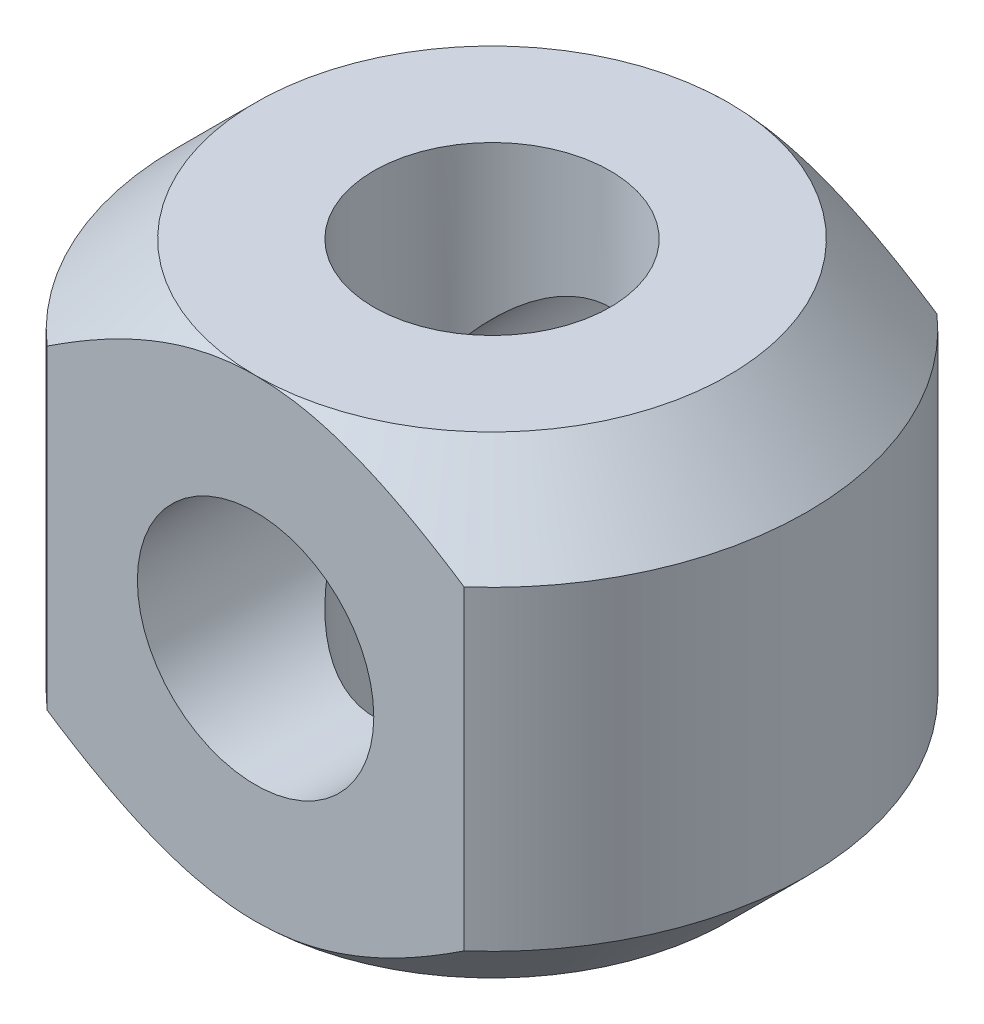
from build123d import *

# Parameters (mm, degrees)
CROQUIS1_R                 = 4
CROQUIS1_R_2               = 1.5
SALIENTE_EXTRUIR3_DEPTH    = 6
CHAFL_N1_SIZE              = 1
CHAFL_N2_SIZE              = 1
CORTAR_EXTRUIR2_DEPTH      = 4
CORTAR_EXTRUIR2_DEPTH_BACK = 4
CROQUIS3_W                 = 2
CROQUIS3_H                 = 6
CROQUIS4_R                 = 1.5
CORTAR_EXTRUIR3_DEPTH      = 6


with BuildPart() as part:
    # Croquis1 → Saliente-Extruir3 (new body)
    with BuildSketch(Plane(origin=(0, 0, 0), x_dir=(1, 0, 0), z_dir=(0, 1, 0))):
        Circle(CROQUIS1_R)
        Circle(CROQUIS1_R_2, mode=Mode.SUBTRACT)
    extrude(amount=SALIENTE_EXTRUIR3_DEPTH)

    # Chaflán1
    chafl_n1_edges = [part.edges().sort_by_distance(p)[0] for p in [
        (-4, 6, 0),
    ]]
    chamfer(chafl_n1_edges, length=CHAFL_N1_SIZE)

    # Chaflán2
    chafl_n2_edges = [part.edges().sort_by_distance(p)[0] for p in [
        (-4, 0, 0),
    ]]
    chamfer(chafl_n2_edges, length=CHAFL_N2_SIZE)

    # Croquis3 → Cortar-Extruir2 (cut, two sides: drawn at the far end of the back side and taken through both)
    with BuildSketch(Plane(origin=(0, 0, 0), x_dir=(0, 0, -1), z_dir=(1, 0, 0)).offset(-CORTAR_EXTRUIR2_DEPTH_BACK)):
        with Locations((-4, 3)):
            Rectangle(CROQUIS3_W, CROQUIS3_H)
        with Locations((4, 3)):
            Rectangle(CROQUIS3_W, CROQUIS3_H)
    extrude(amount=CORTAR_EXTRUIR2_DEPTH + CORTAR_EXTRUIR2_DEPTH_BACK, mode=Mode.SUBTRACT)

    # Croquis4 → Cortar-Extruir3 (cut)
    with BuildSketch(Plane.XY.offset(3)):
        with Locations((0, 3)):
            Circle(CROQUIS4_R)
    extrude(amount=-CORTAR_EXTRUIR3_DEPTH, mode=Mode.SUBTRACT)


solid = part.part
